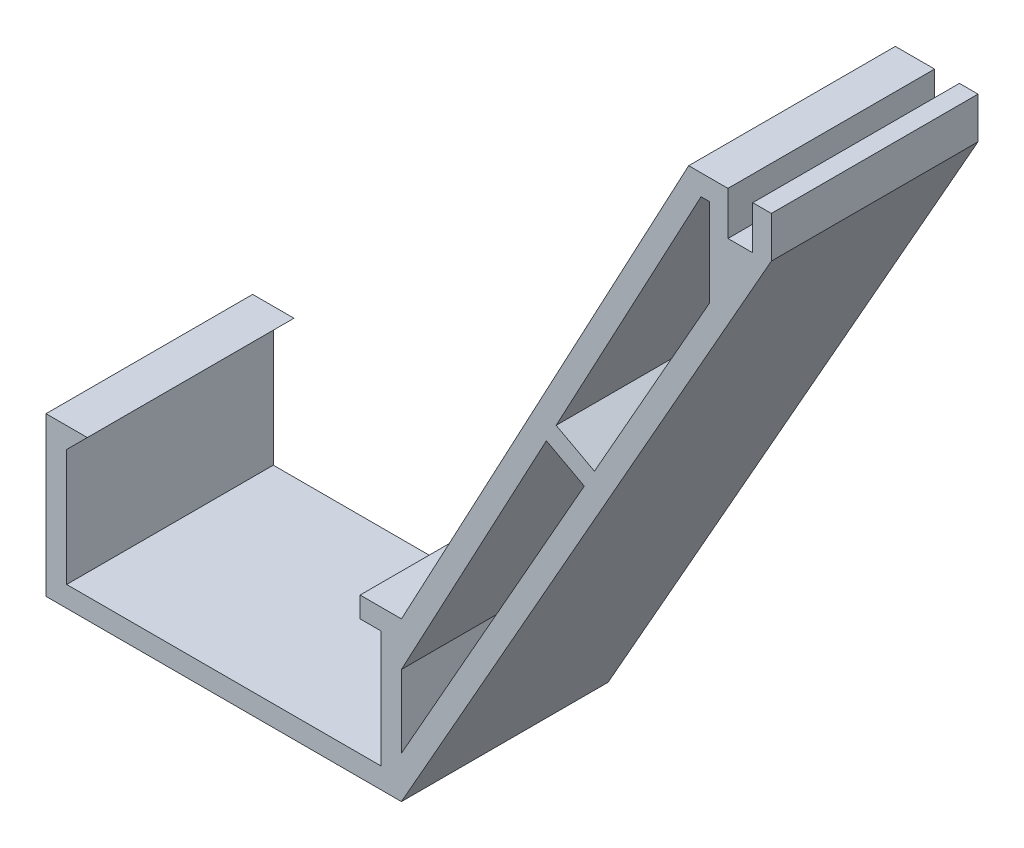
from build123d import *

# Parameters (mm, degrees)
BOSS_EXTRUDE1_DEPTH = 20
BOSS_EXTRUDE2_DEPTH = 20


with BuildPart() as part:
    # Sketch1 → Boss-Extrude1 (new body)
    with BuildSketch(Plane.XY):
        Polygon((-15.2, -15.2), (-15.2, -3.885), (-13.2, -1.885), (-17.2, -1.885), (-17.2, -17.2), (17.2, -17.2), (17.2, -1.885), (13.2, -1.885), (13.2, -3.885), (15.2, -3.885), (15.2, -15.2), align=None)
    extrude(amount=BOSS_EXTRUDE1_DEPTH)

    # Sketch2 → Boss-Extrude2 (add)
    with BuildSketch(Plane(origin=(0, 0, 0), x_dir=(-1, 0, 0), z_dir=(0, 0, -1))):
        Polygon((-45, 50), (-17.2, -1.885), (-17.2, -6.119772924), (-31.226415692, 20.058665139), (-34.89374, 18.093711573), (-17.2, -13.142164629), (-17.2, -17.2), (-53, 46), (-53, 50), (-51.2, 50), (-51.2, 45.8), (-48.8, 45.8), (-48.8, 50), align=None)
        Polygon((-46.197392065, 48), (-32.170976373, 21.821561937), (-35.879759796, 19.834394564), (-47, 39.4656566), (-47, 48), align=None, mode=Mode.SUBTRACT)
    extrude(amount=-BOSS_EXTRUDE2_DEPTH)


solid = part.part
